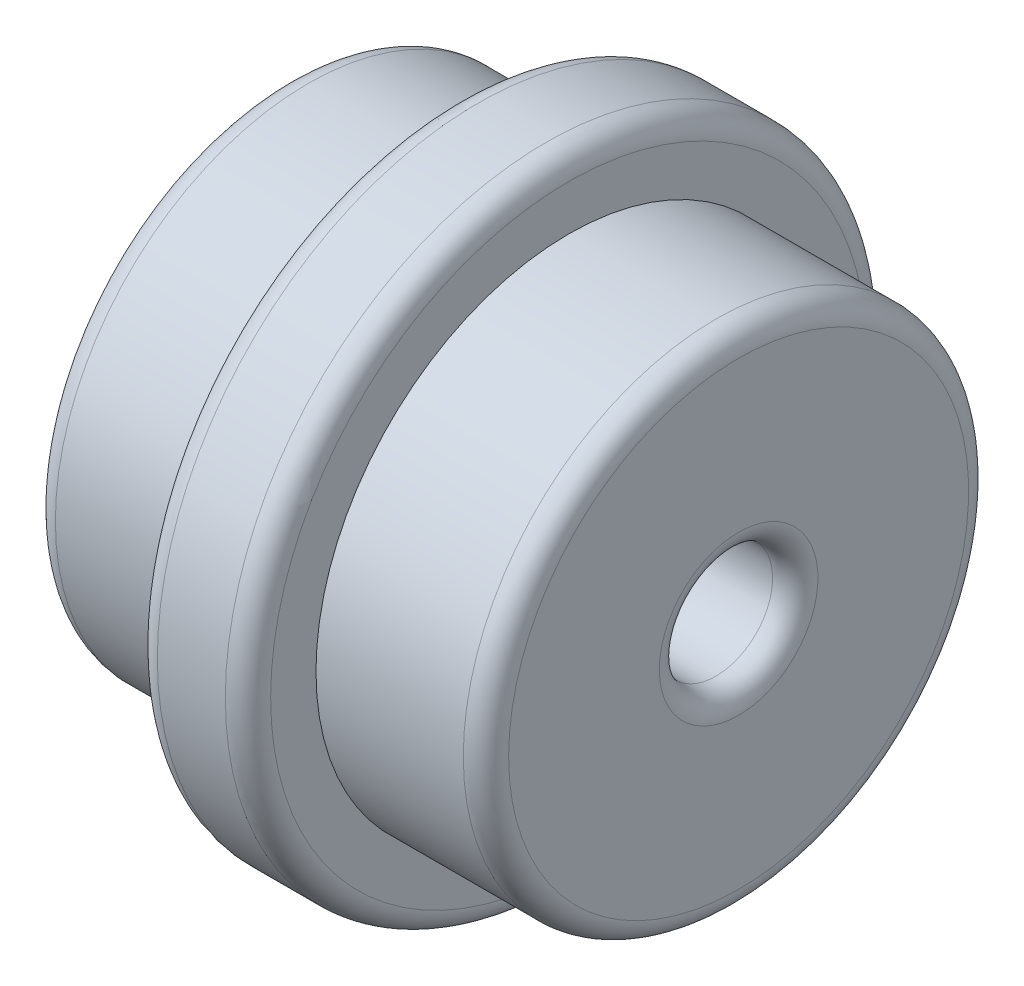
from build123d import *

# Parameters (mm, degrees)
CONG_1_R                = 1
ESQUISSE7_R             = 2.5
ENL_V_MAT_EXTRU_3_DEPTH = 20
CONG_2_R                = 1


with BuildPart() as part:
    # Esquisse1 → Révolution1 (revolve)
    with BuildSketch(Plane.XY, mode=Mode.PRIVATE) as r_volution1_sk:
        Polygon((-10, 0), (10, 0), (10, 11.15), (2.5, 11.15), (2.5, 14.15), (-2.5, 14.15), (-2.5, 11.15), (-10, 11.15), align=None)
    revolve(r_volution1_sk.sketch.rotate(Axis((-10, 0, 0), (1, 0, 0)), 90), axis=Axis((-10, 0, 0), (1, 0, 0)))

    # Congé1
    cong_1_edges = [part.edges().sort_by_distance(p)[0] for p in [
        (-10, 0, -11.15),
        (-2.5, 0, -14.15),
        (2.5, 0, -14.15),
        (10, 0, -11.15),
    ]]
    fillet(cong_1_edges, radius=CONG_1_R)

    # Esquisse7 → Enlèv. mat.-Extru.3 (cut)
    with BuildSketch(Plane.ZY.offset(10)):
        Circle(ESQUISSE7_R)
    extrude(amount=-ENL_V_MAT_EXTRU_3_DEPTH, mode=Mode.SUBTRACT)

    # Congé2
    cong_2_edges = [part.edges().sort_by_distance(p)[0] for p in [
        (10, 0, -2.5),
        (-10, 0, -2.5),
    ]]
    fillet(cong_2_edges, radius=CONG_2_R)


solid = part.part
